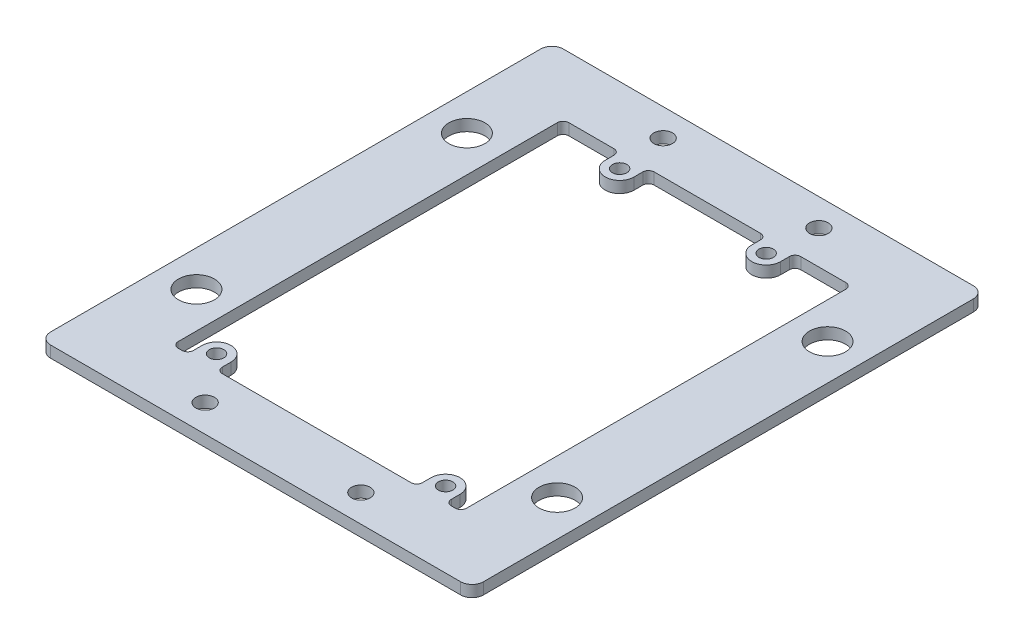
from build123d import *

# Parameters (mm, degrees)
SKETCH1_W           = 120
SKETCH1_H           = 142.16
BOSS_EXTRUDE1_DEPTH = 3.175
SKETCH2_R           = 5
CUT_EXTRUDE1_DEPTH  = 94.072267755
SKETCH3_R           = 2
CUT_EXTRUDE2_DEPTH  = 94.072267755
SKETCH4_R           = 2.5796875
CUT_EXTRUDE3_DEPTH  = 94.072267755
FILLET1_R           = 1.5875
FILLET2_R           = 3.175


with BuildPart() as part:
    # Sketch1 → Boss-Extrude1 (new body)
    with BuildSketch(Plane(origin=(0, 0, 0), x_dir=(1, 0, 0), z_dir=(0, 1, 0))):
        Rectangle(SKETCH1_W, SKETCH1_H)
    extrude(amount=BOSS_EXTRUDE1_DEPTH)

    # Sketch2 → Cut-Extrude1 (cut, through all)
    with BuildSketch(Plane(origin=(0, 3.175, 0), x_dir=(1, 0, 0), z_dir=(0, 1, 0))):
        with Locations(Location((-50, -37.5, 0), (0, 0, 270))):
            Circle(SKETCH2_R)
        with Locations(Location((50, -37.5, 0), (0, 0, 270))):
            Circle(SKETCH2_R)
        with Locations(Location((50, 37.5, 0), (0, 0, 270))):
            Circle(SKETCH2_R)
        with Locations(Location((-50, 37.5, 0), (0, 0, 270))):
            Circle(SKETCH2_R)
    extrude(amount=-CUT_EXTRUDE1_DEPTH, mode=Mode.SUBTRACT)

    # Sketch3 → Cut-Extrude2 (cut, through all)
    with BuildSketch(Plane(origin=(0, 3.175, 0), x_dir=(1, 0, 0), z_dir=(0, 1, 0))):
        with Locations(Location((31.75, -50.165011564, 0), (0, 0, 270))):
            Circle(SKETCH3_R)
        with Locations(Location((-31.75, -50.165011564, 0), (0, 0, 270))):
            Circle(SKETCH3_R)
        with Locations(Location((20.32, 50.165011564, 0), (0, 0, 270))):
            Circle(SKETCH3_R)
        with Locations(Location((-20.32, 50.165011564, 0), (0, 0, 270))):
            Circle(SKETCH3_R)
        with BuildLine():
            Line((-16.32, 50.165011564), (-16.32, 54.165011564))
            Line((-16.32, 54.165011564), (16.32, 54.165011564))
            Line((16.32, 54.165011564), (16.32, 50.165011564))
            ThreePointArc((16.32, 50.165011564), (20.32, 46.165011564), (24.32, 50.165011564))
            Line((24.32, 50.165011564), (24.32, 54.165011564))
            Line((24.32, 54.165011564), (40, 54.165011564))
            Line((40, 54.165011564), (40, -54.165011564))
            Line((40, -54.165011564), (35.75, -54.165011564))
            Line((35.75, -54.165011564), (35.75, -50.165011564))
            ThreePointArc((35.75, -50.165011564), (31.75, -46.165011564), (27.75, -50.165011564))
            Line((27.75, -50.165011564), (27.75, -54.165011564))
            Line((27.75, -54.165011564), (-27.75, -54.165011564))
            Line((-27.75, -54.165011564), (-27.75, -50.165011564))
            ThreePointArc((-27.75, -50.165011564), (-31.75, -46.165011564), (-35.75, -50.165011564))
            Line((-35.75, -50.165011564), (-35.75, -54.165011564))
            Line((-35.75, -54.165011564), (-40, -54.165011564))
            Line((-40, -54.165011564), (-40, 54.165011564))
            Line((-40, 54.165011564), (-24.32, 54.165011564))
            Line((-24.32, 54.165011564), (-24.32, 50.165011564))
            ThreePointArc((-24.32, 50.165011564), (-20.32, 46.165011564), (-16.32, 50.165011564))
        make_face()
    extrude(amount=-CUT_EXTRUDE2_DEPTH, mode=Mode.SUBTRACT)

    # Sketch4 → Cut-Extrude3 (cut, through all)
    with BuildSketch(Plane(origin=(0, 3.175, 0), x_dir=(1, 0, 0), z_dir=(0, 1, 0))):
        with Locations(Location((-21.59, 63.5, 0), (0, 0, 270))):
            Circle(SKETCH4_R)
        with Locations(Location((21.59, 63.5, 0), (0, 0, 270))):
            Circle(SKETCH4_R)
        with Locations(Location((-21.59, -63.5, 0), (0, 0, 90))):
            Circle(SKETCH4_R)
        with Locations(Location((21.59, -63.5, 0), (0, 0, 90))):
            Circle(SKETCH4_R)
    extrude(amount=-CUT_EXTRUDE3_DEPTH, mode=Mode.SUBTRACT)

    # Fillet1
    fillet1_edges = [part.edges().sort_by_distance(p)[0] for p in [
        (-16.32, 1.5875, -54.165011564),
        (16.32, 1.5875, -54.165011564),
        (24.32, 1.5875, -54.165011564),
        (40, 1.5875, -54.165011564),
        (40, 1.5875, 54.165011564),
        (35.75, 1.5875, 54.165011564),
        (27.75, 1.5875, 54.165011564),
        (-27.75, 1.5875, 54.165011564),
        (-35.75, 1.5875, 54.165011564),
        (-40, 1.5875, 54.165011564),
        (-40, 1.5875, -54.165011564),
        (-24.32, 1.5875, -54.165011564),
    ]]
    fillet(fillet1_edges, radius=FILLET1_R)

    # Fillet2
    fillet2_edges = [part.edges().sort_by_distance(p)[0] for p in [
        (60, 1.5875, 71.08),
        (-60, 1.5875, 71.08),
        (-60, 1.5875, -71.08),
        (60, 1.5875, -71.08),
    ]]
    fillet(fillet2_edges, radius=FILLET2_R)


solid = part.part
